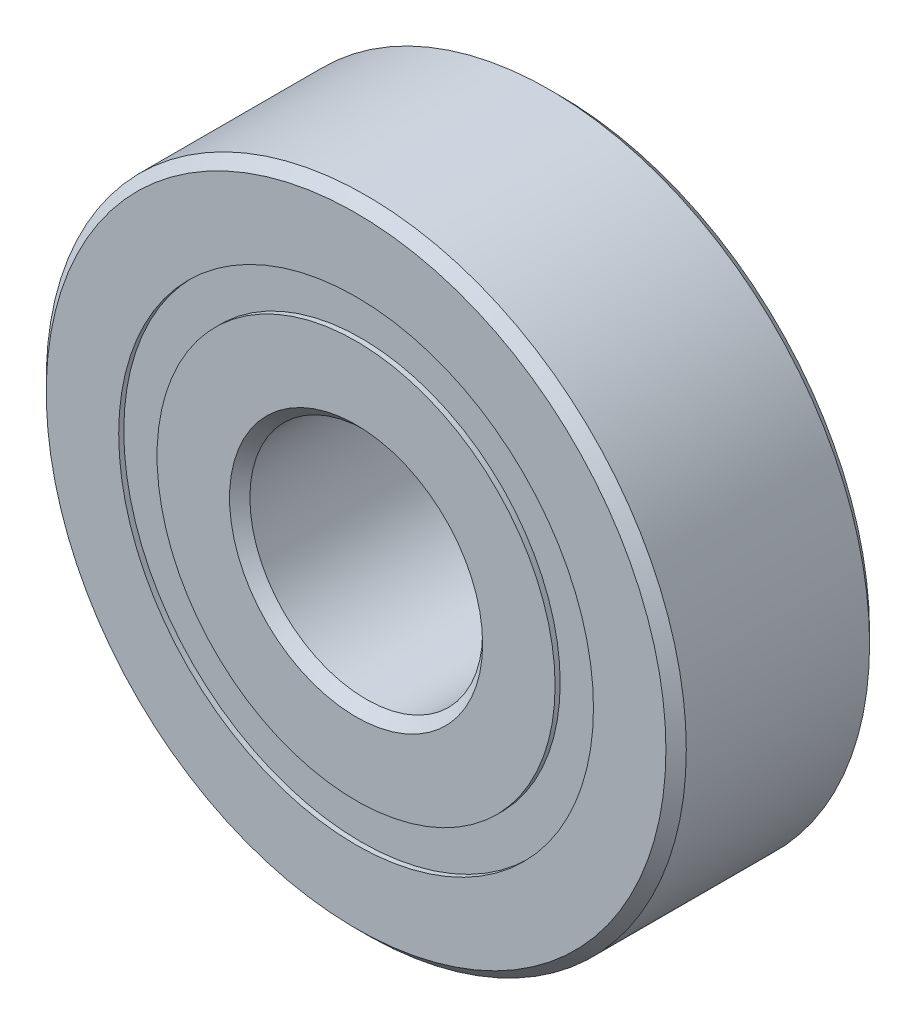
from build123d import *

# Parameters (mm, degrees)
CIRPATTERN1_COUNT = 12
SKETCH5_W         = 1.635478413
SKETCH5_H         = 1.318681318


with BuildPart() as part:
    # Sketch1 → Revolve1 (revolve)
    with BuildSketch(Plane(origin=(0, 0, 0), x_dir=(0, 0, -1), z_dir=(1, 0, 0))):
        with BuildLine():
            Line((3.15, 11), (-3.15, 11))
            Line((-3.15, 11), (-3.5, 10.65))
            Line((-3.5, 10.65), (-3.5, 8.159340659))
            Line((-3.5, 8.159340659), (-1.555555556, 8.159340659))
            ThreePointArc((-1.555555556, 8.159340659), (0, 9.189521587), (1.555555556, 8.159340659))
            Line((1.555555556, 8.159340659), (3.5, 8.159340659))
            Line((3.5, 8.159340659), (3.5, 10.65))
            Line((3.5, 10.65), (3.15, 11))
        make_face()
    revolve(axis=Axis((0, 0, 3.5), (0, 0, -1)))


with BuildPart() as body_2:
    # Sketch3 → Revolve3 (revolve)
    with BuildSketch(Plane(origin=(0, 0, 0), x_dir=(0, 0, -1), z_dir=(1, 0, 0))):
        with BuildLine():
            Line((-3.5, 6.840659341), (-1.555555556, 6.840659341))
            ThreePointArc((-1.555555556, 6.840659341), (0, 5.810478413), (1.555555556, 6.840659341))
            Line((1.555555556, 6.840659341), (3.5, 6.840659341))
            Line((3.5, 6.840659341), (3.5, 4.35))
            Line((3.5, 4.35), (3.15, 4))
            Line((3.15, 4), (-3.15, 4))
            Line((-3.15, 4), (-3.5, 4.35))
            Line((-3.5, 4.35), (-3.5, 6.840659341))
        make_face()
    revolve(axis=Axis((0, 0, 3.5), (0, 0, -1)))


with BuildPart() as body_3:
    # Sketch4 → Revolve4 (revolve)
    with BuildSketch(Plane(origin=(0, 0, 0), x_dir=(0, 0, -1), z_dir=(1, 0, 0))):
        with BuildLine():
            Line((-1.689521587, 7.5), (1.689521587, 7.5))
            ThreePointArc((1.689521587, 7.5), (0, 9.189521587), (-1.689521587, 7.5))
        make_face()
    revolve(axis=Axis((0, 7.5, 1.689521587), (0, 0, -1)))


with BuildPart() as cirpattern1_1:
    # CirPattern1: pattern copy
    add(body_3.part.rotate(Axis((0, 0, -3.5), (0, 0, 1)), 1 * 360 / CIRPATTERN1_COUNT))


with BuildPart() as cirpattern1_2:
    # CirPattern1: pattern copy
    add(body_3.part.rotate(Axis((0, 0, -3.5), (0, 0, 1)), 2 * 360 / CIRPATTERN1_COUNT))


with BuildPart() as cirpattern1_3:
    # CirPattern1: pattern copy
    add(body_3.part.rotate(Axis((0, 0, -3.5), (0, 0, 1)), 3 * 360 / CIRPATTERN1_COUNT))


with BuildPart() as cirpattern1_4:
    # CirPattern1: pattern copy
    add(body_3.part.rotate(Axis((0, 0, -3.5), (0, 0, 1)), 4 * 360 / CIRPATTERN1_COUNT))


with BuildPart() as cirpattern1_5:
    # CirPattern1: pattern copy
    add(body_3.part.rotate(Axis((0, 0, -3.5), (0, 0, 1)), 5 * 360 / CIRPATTERN1_COUNT))


with BuildPart() as cirpattern1_6:
    # CirPattern1: pattern copy
    add(body_3.part.rotate(Axis((0, 0, -3.5), (0, 0, 1)), 6 * 360 / CIRPATTERN1_COUNT))


with BuildPart() as cirpattern1_7:
    # CirPattern1: pattern copy
    add(body_3.part.rotate(Axis((0, 0, -3.5), (0, 0, 1)), 7 * 360 / CIRPATTERN1_COUNT))


with BuildPart() as cirpattern1_8:
    # CirPattern1: pattern copy
    add(body_3.part.rotate(Axis((0, 0, -3.5), (0, 0, 1)), 8 * 360 / CIRPATTERN1_COUNT))


with BuildPart() as cirpattern1_9:
    # CirPattern1: pattern copy
    add(body_3.part.rotate(Axis((0, 0, -3.5), (0, 0, 1)), 9 * 360 / CIRPATTERN1_COUNT))


with BuildPart() as cirpattern1_10:
    # CirPattern1: pattern copy
    add(body_3.part.rotate(Axis((0, 0, -3.5), (0, 0, 1)), 10 * 360 / CIRPATTERN1_COUNT))


with BuildPart() as cirpattern1_11:
    # CirPattern1: pattern copy
    add(body_3.part.rotate(Axis((0, 0, -3.5), (0, 0, 1)), 11 * 360 / CIRPATTERN1_COUNT))


with BuildPart() as body_15:
    # Sketch5 → Revolve5 (revolve)
    with BuildSketch(Plane(origin=(0, 0, 0), x_dir=(0, 0, -1), z_dir=(1, 0, 0))):
        with Locations((-2.507260794, 7.5)):
            Rectangle(SKETCH5_W, SKETCH5_H)
        with Locations((2.507260794, 7.5)):
            Rectangle(SKETCH5_W, SKETCH5_H)
    revolve(axis=Axis((0, 0, 3.5), (0, 0, -1)))


solid = Compound([part.part, body_2.part, body_3.part, cirpattern1_1.part, cirpattern1_2.part, cirpattern1_3.part, cirpattern1_4.part, cirpattern1_5.part, cirpattern1_6.part, cirpattern1_7.part, cirpattern1_8.part, cirpattern1_9.part, cirpattern1_10.part, cirpattern1_11.part, body_15.part])
